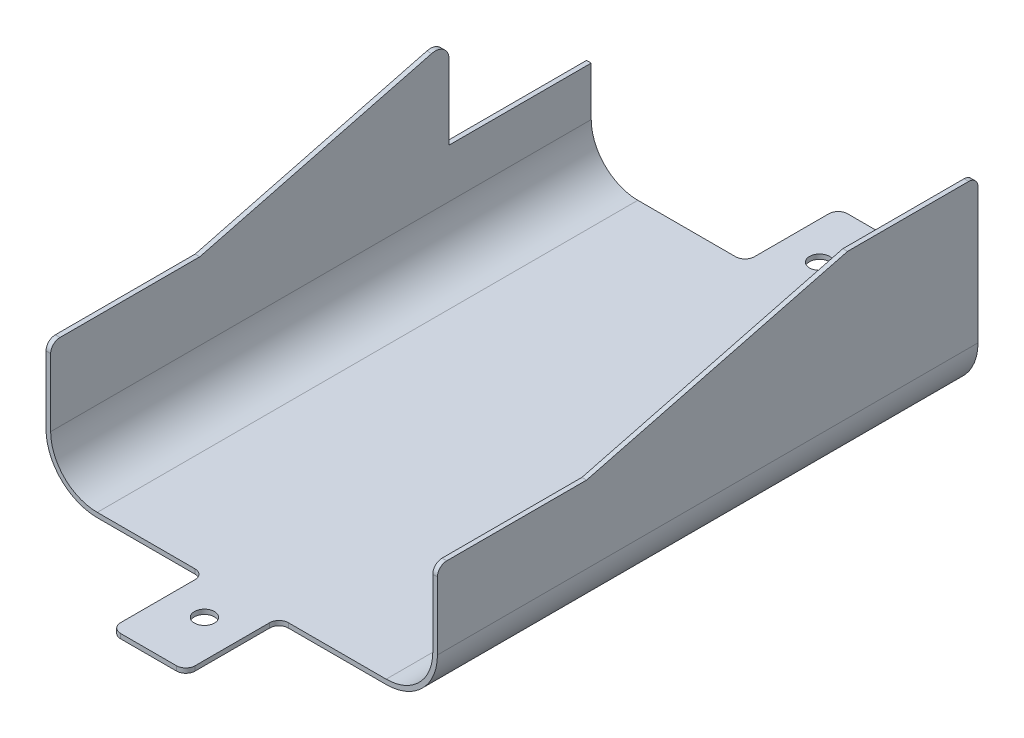
from build123d import *

# Parameters (mm, degrees)
BOSS_EXTRUDE1_DEPTH = 116
SKETCH2_W           = 16
SKETCH2_H           = 20
BOSS_EXTRUDE2_DEPTH = 1
CUT_EXTRUDE1_DEPTH  = 163.549223314
FILLET1_R           = 2
CUT_EXTRUDE2_DEPTH  = 1
FILLET2_R           = 3
SKETCH6_R           = 2.15
CUT_EXTRUDE3_DEPTH  = 1


with BuildPart() as part:
    # Sketch1 → Boss-Extrude1 (new body)
    with BuildSketch(Plane.XY):
        with BuildLine():
            Line((-42, 18.5), (-42, -18.5))
            ThreePointArc((-42, -18.5), (-38.778174593, -26.278174593), (-31, -29.5))
            Line((-31, -29.5), (31, -29.5))
            ThreePointArc((31, -29.5), (38.778174593, -26.278174593), (42, -18.5))
            Line((42, -18.5), (42, 18.5))
            ThreePointArc((42, 18.5), (38.778174593, 26.278174593), (31, 29.5))
            Line((31, 29.5), (-31, 29.5))
            ThreePointArc((-31, 29.5), (-38.778174593, 26.278174593), (-42, 18.5))
        make_face()
        with BuildLine():
            ThreePointArc((-31, 28.5), (-38.071067812, 25.571067812), (-41, 18.5))
            Line((-41, 18.5), (-41, -18.5))
            ThreePointArc((-41, -18.5), (-38.071067812, -25.571067812), (-31, -28.5))
            Line((-31, -28.5), (31, -28.5))
            ThreePointArc((31, -28.5), (38.071067812, -25.571067812), (41, -18.5))
            Line((41, -18.5), (41, 18.5))
            ThreePointArc((41, 18.5), (38.071067812, 25.571067812), (31, 28.5))
            Line((31, 28.5), (-31, 28.5))
        make_face(mode=Mode.SUBTRACT)
    extrude(amount=-BOSS_EXTRUDE1_DEPTH)

    # Sketch2 → Boss-Extrude2 (add)
    with BuildSketch(Plane.XZ.offset(29.5)):
        with Locations((0, 10)):
            Rectangle(SKETCH2_W, SKETCH2_H)
        with Locations((0, -126)):
            Rectangle(SKETCH2_W, SKETCH2_H)
    extrude(amount=-BOSS_EXTRUDE2_DEPTH)

    # Sketch3 → Cut-Extrude1 (cut, through all)
    with BuildSketch(Plane(origin=(42, 0, 0), x_dir=(0, 0, -1), z_dir=(1, 0, 0))):
        Polygon((0, -2), (32, -2), (88, 12.5), (116, 12.5), (116, 29.5), (0, 29.5), align=None)
    extrude(amount=-CUT_EXTRUDE1_DEPTH, mode=Mode.SUBTRACT)

    # Fillet1
    fillet1_edges = [part.edges().sort_by_distance(p)[0] for p in [
        (8, -29, 20),
        (8, -29, 0),
        (-8, -29, 0),
        (-8, -29, 20),
        (-8, -29, -136),
        (-8, -29, -116),
        (8, -29, -116),
        (8, -29, -136),
        (41.5, -2, 0),
        (-41.5, 12.5, -116),
        (41.5, 12.5, -116),
        (-41.5, -2, 0),
    ]]
    fillet(fillet1_edges, radius=FILLET1_R)

    # Sketch5 → Cut-Extrude2 (cut)
    with BuildSketch(Plane.ZY.offset(42)):
        with BuildLine():
            Line((-113, -8), (-113, 12.5))
            Line((-113, 12.5), (-114, 12.5))
            ThreePointArc((-114, 12.5), (-115.414213562, 11.914213562), (-116, 10.5))
            Line((-116, 10.5), (-116, -8))
            Line((-116, -8), (-113, -8))
        make_face()
        Polygon((-88, 12.5), (-113, 12.5), (-113, -8), (-85.5, -8), (-85.5, 11.852678571), align=None)
    extrude(amount=-CUT_EXTRUDE2_DEPTH, mode=Mode.SUBTRACT)

    # Fillet2
    fillet2_edges = [part.edges().sort_by_distance(p)[0] for p in [
        (-41.5, 11.852678571, -85.5),
    ]]
    fillet(fillet2_edges, radius=FILLET2_R)

    # Sketch6 → Cut-Extrude3 (cut)
    with BuildSketch(Plane.XZ.offset(29.5)):
        with Locations((0, -124)):
            Circle(SKETCH6_R)
        with Locations((0, 8)):
            Circle(SKETCH6_R)
    extrude(amount=-CUT_EXTRUDE3_DEPTH, mode=Mode.SUBTRACT)


solid = part.part
